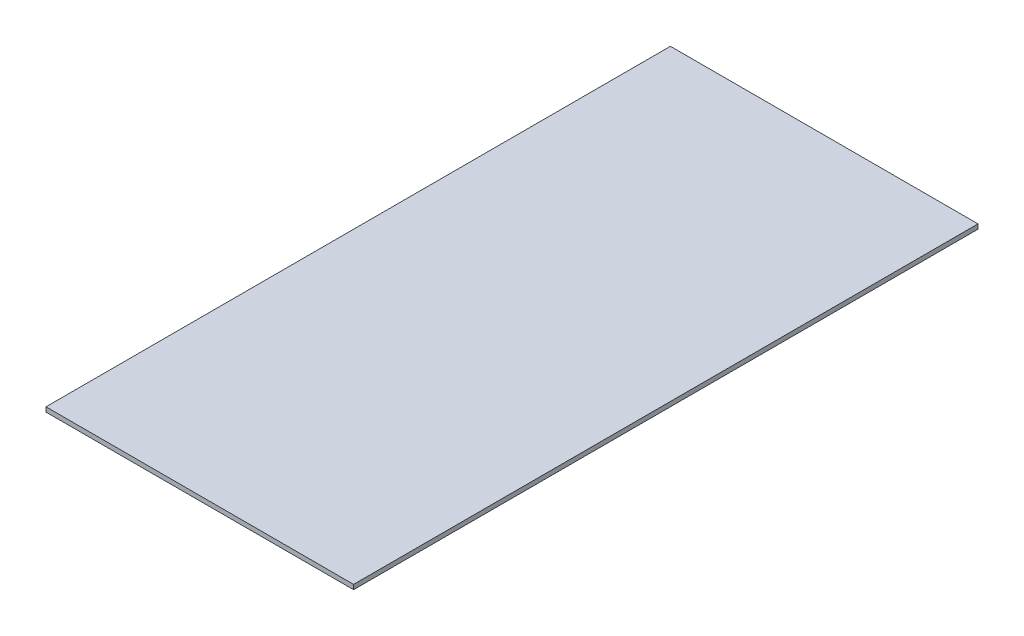
from build123d import *

# Parameters (mm, degrees)
SKETCH1_W           = 200
SKETCH1_H           = 406
BOSS_EXTRUDE1_DEPTH = 3


with BuildPart() as part:
    # Sketch1 → Boss-Extrude1 (new body)
    with BuildSketch(Plane(origin=(0, 0, 0), x_dir=(1, 0, 0), z_dir=(0, 1, 0))):
        Rectangle(SKETCH1_W, SKETCH1_H)
    extrude(amount=BOSS_EXTRUDE1_DEPTH)


solid = part.part
